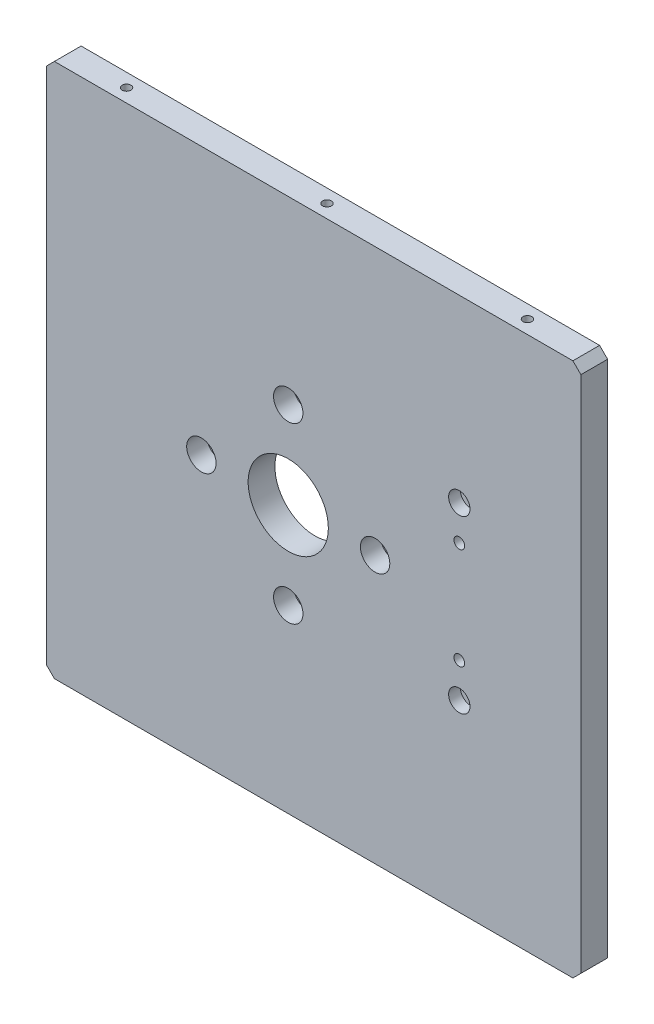
from build123d import *

# Parameters (mm, degrees)
ESQUISSE1_W                                        = 200
ESQUISSE1_H                                        = 200
BOSS_EXTRU_1_DEPTH                                 = 10
ESQUISSE2_R                                        = 15
ENL_V_MAT_EXTRU_1_DEPTH                            = 142.774468788
CHANFREIN1_SIZE                                    = 3
CHAMBRAGE_POUR_VIS_T_TE_HEXAGONALE_M41_D           = 4.5
CHAMBRAGE_POUR_VIS_T_TE_HEXAGONALE_M41_CBORE_D     = 8
CHAMBRAGE_POUR_VIS_T_TE_HEXAGONALE_M41_CBORE_DEPTH = 4.4
TROUS_DE_CENTRAGE_4_0MMCLEARANCE_1_D               = 4
CHAMBRAGE_POUR_VIS_T_TE_HEXAGONALE_M61_D           = 6.6
CHAMBRAGE_POUR_VIS_T_TE_HEXAGONALE_M61_CBORE_D     = 11
CHAMBRAGE_POUR_VIS_T_TE_HEXAGONALE_M61_CBORE_DEPTH = 7.4
TROU_TARAUD_M41_D                                  = 3.3
TROU_TARAUD_M41_DEPTH                              = 14
TROU_TARAUD_M41_TIP                                = 0.991420021
TROU_TARAUD_M42_D                                  = 3.3
TROU_TARAUD_M42_DEPTH                              = 14
TROU_TARAUD_M42_TIP                                = 0.991420021
TROU_TARAUD_M52_D                                  = 4.2
TROU_TARAUD_M52_DEPTH                              = 15


with BuildPart() as part:
    # Esquisse1 → Boss.-Extru.1 (new body)
    with BuildSketch(Plane.XY):
        Rectangle(ESQUISSE1_W, ESQUISSE1_H)
    extrude(amount=BOSS_EXTRU_1_DEPTH)

    # Esquisse2 → Enlèv. mat.-Extru.1 (cut, through all)
    with BuildSketch(Plane.XY.offset(10)):
        with Locations((-9.5, 0)):
            Circle(ESQUISSE2_R)
    extrude(amount=-ENL_V_MAT_EXTRU_1_DEPTH, mode=Mode.SUBTRACT)

    # Chanfrein1
    chanfrein1_edges = [part.edges().sort_by_distance(p)[0] for p in [
        (-100, 100, 5),
        (100, 100, 5),
        (100, -100, 5),
        (-100, -100, 5),
    ]]
    chamfer(chanfrein1_edges, length=CHANFREIN1_SIZE)

    # Chambrage pour vis à tête hexagonale M41 (through all)
    with Locations(Plane(origin=(54.5, 32.7, 10), x_dir=(1, 0, 0), z_dir=(0, 0, 1))):
        with Locations((0, 0), (0, -64)):
            CounterBoreHole(CHAMBRAGE_POUR_VIS_T_TE_HEXAGONALE_M41_D / 2, CHAMBRAGE_POUR_VIS_T_TE_HEXAGONALE_M41_CBORE_D / 2, CHAMBRAGE_POUR_VIS_T_TE_HEXAGONALE_M41_CBORE_DEPTH)

    # Trous de centrage Ø4.0mmClearance 1 (through all)
    with Locations(Plane(origin=(54.5, -18.3, 10), x_dir=(1, 0, 0), z_dir=(0, 0, 1))):
        with Locations((0, 0), (0, 38)):
            Hole(TROUS_DE_CENTRAGE_4_0MMCLEARANCE_1_D / 2)

    # Chambrage pour vis à tête hexagonale M61 (through all)
    with Locations(Plane.XY.offset(10)):
        with Locations((23, 0), (-9.5, 32.5), (-42, 0), (-9.5, -32.5)):
            CounterBoreHole(CHAMBRAGE_POUR_VIS_T_TE_HEXAGONALE_M61_D / 2, CHAMBRAGE_POUR_VIS_T_TE_HEXAGONALE_M61_CBORE_D / 2, CHAMBRAGE_POUR_VIS_T_TE_HEXAGONALE_M61_CBORE_DEPTH)

    # Trou taraudé M41
    with Locations(Plane(origin=(0, 100, 0), x_dir=(1, 0, 0), z_dir=(0, 1, 0))):
        with Locations((-75, -5), (0, -5), (75, -5)):
            Hole(TROU_TARAUD_M41_D / 2, depth=TROU_TARAUD_M41_DEPTH)
            with Locations((0, 0, -(TROU_TARAUD_M41_DEPTH + TROU_TARAUD_M41_TIP / 2))):  # 118° drill point
                Cone(0, TROU_TARAUD_M41_D / 2, TROU_TARAUD_M41_TIP, mode=Mode.SUBTRACT)

    # Trou taraudé M42
    with Locations(Plane(origin=(0, -100, 0), x_dir=(-1, 0, 0), z_dir=(0, -1, 0))):
        with Locations((75, -5), (0, -5), (-75, -5)):
            Hole(TROU_TARAUD_M42_D / 2, depth=TROU_TARAUD_M42_DEPTH)
            with Locations((0, 0, -(TROU_TARAUD_M42_DEPTH + TROU_TARAUD_M42_TIP / 2))):  # 118° drill point
                Cone(0, TROU_TARAUD_M42_D / 2, TROU_TARAUD_M42_TIP, mode=Mode.SUBTRACT)

    # Trou taraudé M52
    with Locations(Plane.ZY.offset(100)):
        with Locations((5, 0), (5, -75), (5, 75)):
            Hole(TROU_TARAUD_M52_D / 2, depth=TROU_TARAUD_M52_DEPTH)


solid = part.part
